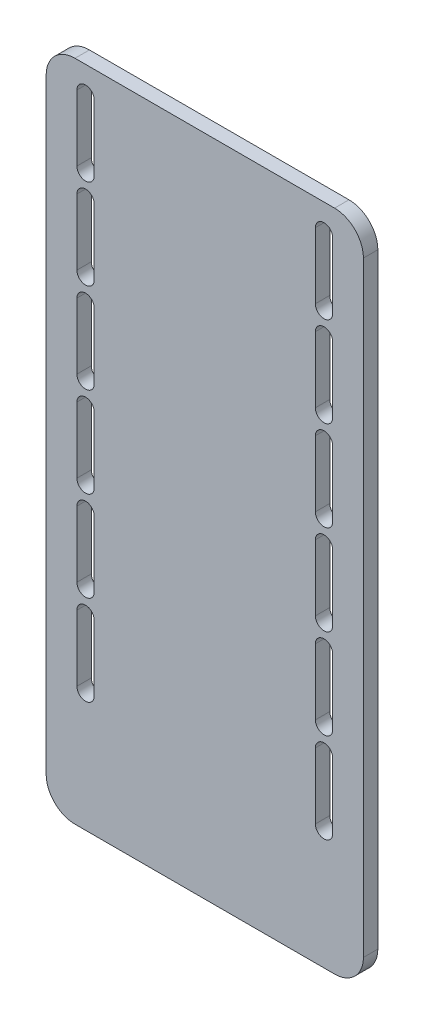
from build123d import *

# Parameters (mm, degrees)
SKETCH1_W           = 139.7
SKETCH1_H           = 292.1
BOSS_EXTRUDE1_DEPTH = 6.35
FILLET1_R           = 12.7
CUT_EXTRUDE1_DEPTH  = 6.35


with BuildPart() as part:
    # Sketch1 → Boss-Extrude1 (new body)
    with BuildSketch(Plane.XY):
        Rectangle(SKETCH1_W, SKETCH1_H)
    extrude(amount=BOSS_EXTRUDE1_DEPTH)

    # Fillet1
    fillet1_edges = [part.edges().sort_by_distance(p)[0] for p in [
        (-69.85, -146.05, 3.175),
        (69.85, -146.05, 3.175),
        (69.85, 146.05, 3.175),
        (-69.85, 146.05, 3.175),
    ]]
    fillet(fillet1_edges, radius=FILLET1_R)

    # Sketch2 → Cut-Extrude1 (cut)
    with BuildSketch(Plane.XY.offset(6.35)):
        with BuildLine():
            Line((48.69815, 134.366), (48.69815, 105.3592))
            ThreePointArc((48.69815, 105.3592), (52.50815, 101.5492), (56.31815, 105.3592))
            Line((56.31815, 105.3592), (56.31815, 134.366))
            ThreePointArc((56.31815, 134.366), (52.50815, 138.176), (48.69815, 134.366))
        make_face()
        with BuildLine():
            Line((-56.31815, 134.366), (-56.31815, 105.3592))
            ThreePointArc((-56.31815, 105.3592), (-52.50815, 101.5492), (-48.69815, 105.3592))
            Line((-48.69815, 105.3592), (-48.69815, 134.366))
            ThreePointArc((-48.69815, 134.366), (-52.50815, 138.176), (-56.31815, 134.366))
        make_face()
        with BuildLine():
            Line((-56.31815, 94.6912), (-56.31815, 65.6844))
            ThreePointArc((-56.31815, 65.6844), (-52.50815, 61.8744), (-48.69815, 65.6844))
            Line((-48.69815, 65.6844), (-48.69815, 94.6912))
            ThreePointArc((-48.69815, 94.6912), (-52.50815, 98.5012), (-56.31815, 94.6912))
        make_face()
        with BuildLine():
            Line((-56.31815, 55.0164), (-56.31815, 26.0096))
            ThreePointArc((-56.31815, 26.0096), (-52.50815, 22.1996), (-48.69815, 26.0096))
            Line((-48.69815, 26.0096), (-48.69815, 55.0164))
            ThreePointArc((-48.69815, 55.0164), (-52.50815, 58.8264), (-56.31815, 55.0164))
        make_face()
        with BuildLine():
            Line((-56.31815, 15.3416), (-56.31815, -13.6652))
            ThreePointArc((-56.31815, -13.6652), (-52.50815, -17.4752), (-48.69815, -13.6652))
            Line((-48.69815, -13.6652), (-48.69815, 15.3416))
            ThreePointArc((-48.69815, 15.3416), (-52.50815, 19.1516), (-56.31815, 15.3416))
        make_face()
        with BuildLine():
            Line((-56.31815, -24.3332), (-56.31815, -53.34))
            ThreePointArc((-56.31815, -53.34), (-52.50815, -57.15), (-48.69815, -53.34))
            Line((-48.69815, -53.34), (-48.69815, -24.3332))
            ThreePointArc((-48.69815, -24.3332), (-52.50815, -20.5232), (-56.31815, -24.3332))
        make_face()
        with BuildLine():
            Line((-56.31815, -64.008), (-56.31815, -93.0148))
            ThreePointArc((-56.31815, -93.0148), (-52.50815, -96.8248), (-48.69815, -93.0148))
            Line((-48.69815, -93.0148), (-48.69815, -64.008))
            ThreePointArc((-48.69815, -64.008), (-52.50815, -60.198), (-56.31815, -64.008))
        make_face()
        with BuildLine():
            Line((48.69815, 94.6912), (48.69815, 65.6844))
            ThreePointArc((48.69815, 65.6844), (52.50815, 61.8744), (56.31815, 65.6844))
            Line((56.31815, 65.6844), (56.31815, 94.6912))
            ThreePointArc((56.31815, 94.6912), (52.50815, 98.5012), (48.69815, 94.6912))
        make_face()
        with BuildLine():
            Line((48.69815, 55.0164), (48.69815, 26.0096))
            ThreePointArc((48.69815, 26.0096), (52.50815, 22.1996), (56.31815, 26.0096))
            Line((56.31815, 26.0096), (56.31815, 55.0164))
            ThreePointArc((56.31815, 55.0164), (52.50815, 58.8264), (48.69815, 55.0164))
        make_face()
        with BuildLine():
            Line((48.69815, 15.3416), (48.69815, -13.6652))
            ThreePointArc((48.69815, -13.6652), (52.50815, -17.4752), (56.31815, -13.6652))
            Line((56.31815, -13.6652), (56.31815, 15.3416))
            ThreePointArc((56.31815, 15.3416), (52.50815, 19.1516), (48.69815, 15.3416))
        make_face()
        with BuildLine():
            Line((48.69815, -24.3332), (48.69815, -53.34))
            ThreePointArc((48.69815, -53.34), (52.50815, -57.15), (56.31815, -53.34))
            Line((56.31815, -53.34), (56.31815, -24.3332))
            ThreePointArc((56.31815, -24.3332), (52.50815, -20.5232), (48.69815, -24.3332))
        make_face()
        with BuildLine():
            Line((48.69815, -64.008), (48.69815, -93.0148))
            ThreePointArc((48.69815, -93.0148), (52.50815, -96.8248), (56.31815, -93.0148))
            Line((56.31815, -93.0148), (56.31815, -64.008))
            ThreePointArc((56.31815, -64.008), (52.50815, -60.198), (48.69815, -64.008))
        make_face()
    extrude(amount=-CUT_EXTRUDE1_DEPTH, mode=Mode.SUBTRACT)


solid = part.part
